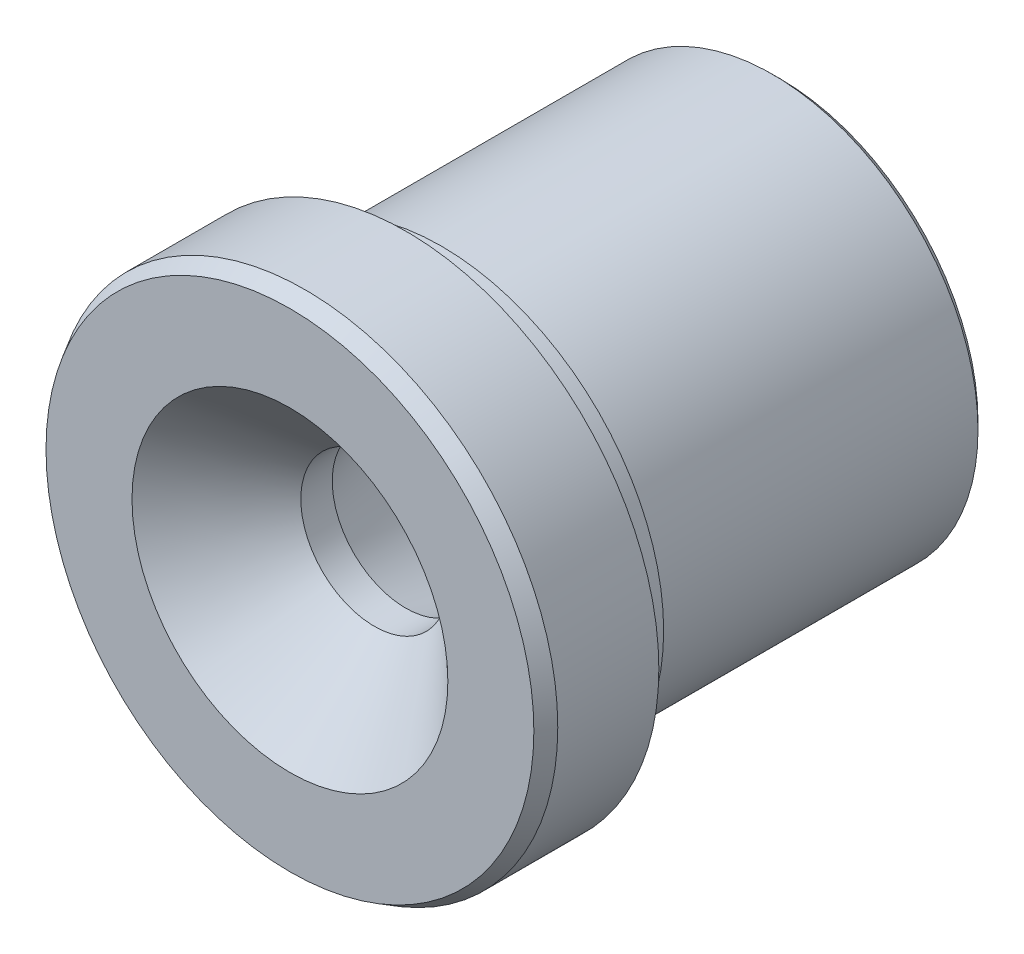
from build123d import *

# Parameters (mm, degrees)
CHAMFER1_SIZE  = 0.762
CHAMFER1_SIZE2 = 0.439940905
CHAMFER2_SIZE  = 0.381


with BuildPart() as part:
    # Sketch1 → Revolve1 (revolve)
    with BuildSketch(Plane(origin=(0, 0, 0), x_dir=(0, 0, -1), z_dir=(1, 0, 0)), mode=Mode.PRIVATE) as revolve1_sk:
        Polygon((24.638, -10.3251), (24.638, -8.7376), (5.821373033, -3.6957), (4.2418, -3.6957), (0, -7.9375), (0, -12.7), (5.842, -12.7), (5.842, -11.1633), (7.62, -11.1633), (7.62, -10.3251), align=None)
    revolve(revolve1_sk.sketch.rotate(Axis((0, 0, -6.716573557), (0, 0, -1)), 270), axis=Axis((0, 0, -6.716573557), (0, 0, -1)))

    # Chamfer1
    chamfer1_edges = [part.edges().sort_by_distance(p)[0] for p in [
        (-12.7, 0, 0),
    ]]
    chamfer1_side = [part.faces().sort_by_distance(p)[0] for p in [
        (-12.7, 0, -2.921),
    ]]
    chamfer(chamfer1_edges, length=CHAMFER1_SIZE, length2=CHAMFER1_SIZE2, reference=chamfer1_side[0])

    # Chamfer2
    chamfer2_edges = [part.edges().sort_by_distance(p)[0] for p in [
        (-10.3251, 0, -24.638),
    ]]
    chamfer(chamfer2_edges, length=CHAMFER2_SIZE)


solid = part.part
